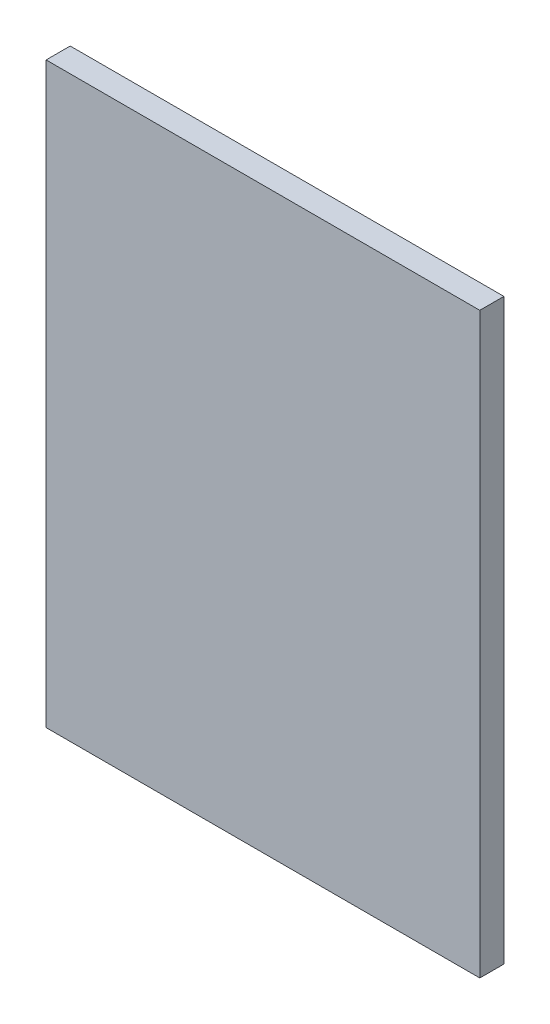
from build123d import *

# Parameters (mm, degrees)
SKETCH1_W           = 228.6
SKETCH1_H           = 304.8
BOSS_EXTRUDE1_DEPTH = 12.7


with BuildPart() as part:
    # Sketch1 → Boss-Extrude1 (new body)
    with BuildSketch(Plane.XY):
        with Locations((114.3, 152.4)):
            Rectangle(SKETCH1_W, SKETCH1_H)
    extrude(amount=BOSS_EXTRUDE1_DEPTH)


solid = part.part
